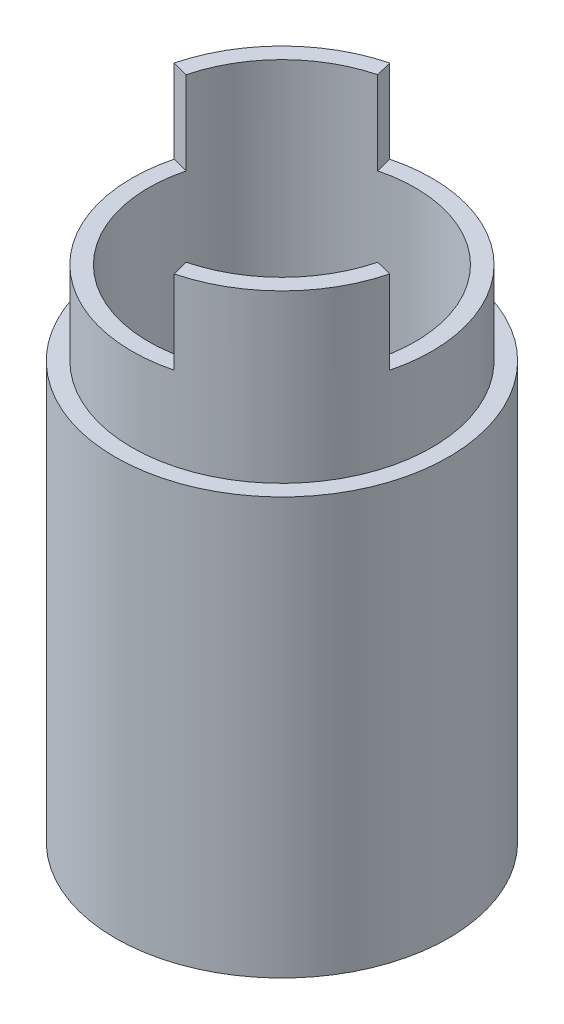
from build123d import *

# Parameters (mm, degrees)
SKETCH_1_R      = 20
SKETCH_1_R_2    = 16
EXTRUDE_1_DEPTH = 50
EXTRUDE_START   = 50
SKETCH_3_R      = 18
SKETCH_3_R_2    = 16
EXTRUDE_2_DEPTH = 10
EXTRUDE_START_2 = 60
EXTRUDE_3_DEPTH = 10


with BuildPart() as part:
    # 草图1 → 凸台-拉伸1 (new body)
    with BuildSketch(Plane(origin=(0, 0, 0), x_dir=(1, 0, 0), z_dir=(0, 1, 0))):
        Circle(SKETCH_1_R)
        Circle(SKETCH_1_R_2, mode=Mode.SUBTRACT)
    extrude(amount=EXTRUDE_1_DEPTH)

    # 草图3 → 凸台-拉伸2 (add)
    with BuildSketch(Plane(origin=(0, 0, 0), x_dir=(1, 0, 0), z_dir=(0, 1, 0)).offset(EXTRUDE_START)):
        Circle(SKETCH_3_R)
        Circle(SKETCH_3_R_2, mode=Mode.SUBTRACT)
    extrude(amount=EXTRUDE_2_DEPTH)

    # 草图4 → 凸台-拉伸3 (add)
    with BuildSketch(Plane(origin=(0, 0, 0), x_dir=(1, 0, 0), z_dir=(0, 1, 0)).offset(EXTRUDE_START_2)):
        with BuildLine():
            Line((-17.428425058, 4.5), (-15.491933385, 4))
            ThreePointArc((-15.491933385, 4), (-11.313708499, 11.313708499), (-4, 15.491933385))
            Line((-4, 15.491933385), (-4.5, 17.428425058))
            ThreePointArc((-4.5, 17.428425058), (-12.727922061, 12.727922061), (-17.428425058, 4.5))
        make_face()
        with BuildLine():
            ThreePointArc((15.491933385, -4), (11.313708499, -11.313708499), (4, -15.491933385))
            Line((4, -15.491933385), (4.5, -17.428425058))
            ThreePointArc((4.5, -17.428425058), (12.727922061, -12.727922061), (17.428425058, -4.5))
            Line((17.428425058, -4.5), (15.491933385, -4))
        make_face()
    extrude(amount=EXTRUDE_3_DEPTH)


solid = part.part
